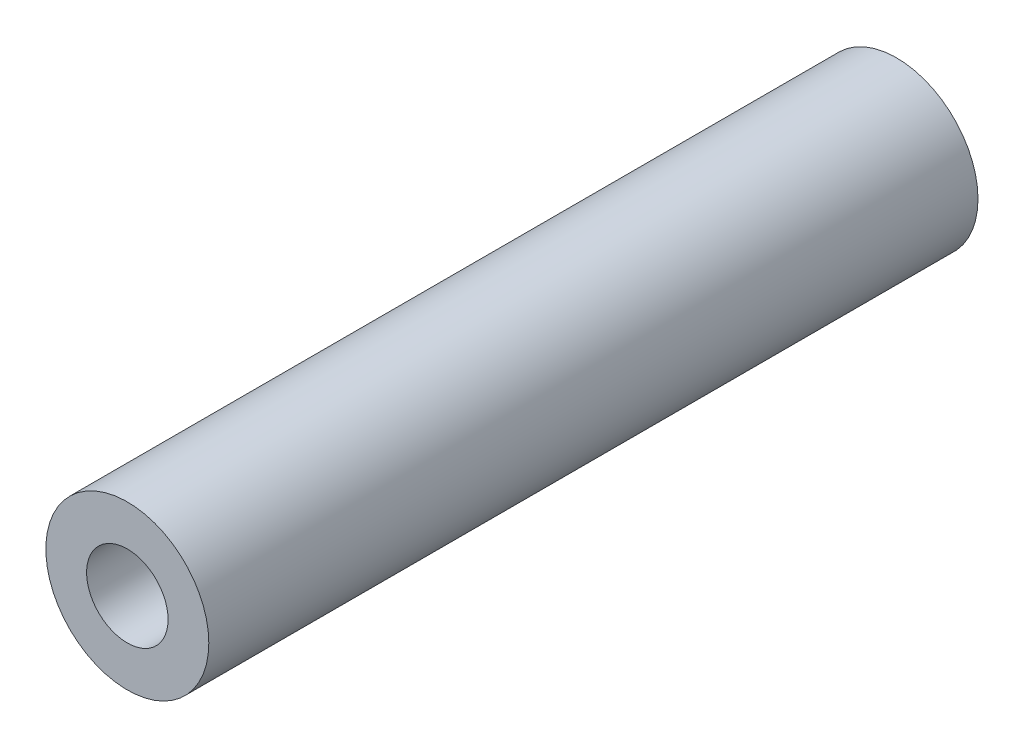
from build123d import *

# Parameters (mm, degrees)
SKETCH1_R      = 0.635
SKETCH1_R_2    = 0.3175
EXTRUDE1_DEPTH = 5.9944


with BuildPart() as part:
    # Sketch1 → Extrude1 (new body)
    with BuildSketch(Plane.XY):
        Circle(SKETCH1_R)
        Circle(SKETCH1_R_2, mode=Mode.SUBTRACT)
    extrude(amount=EXTRUDE1_DEPTH)


solid = part.part
